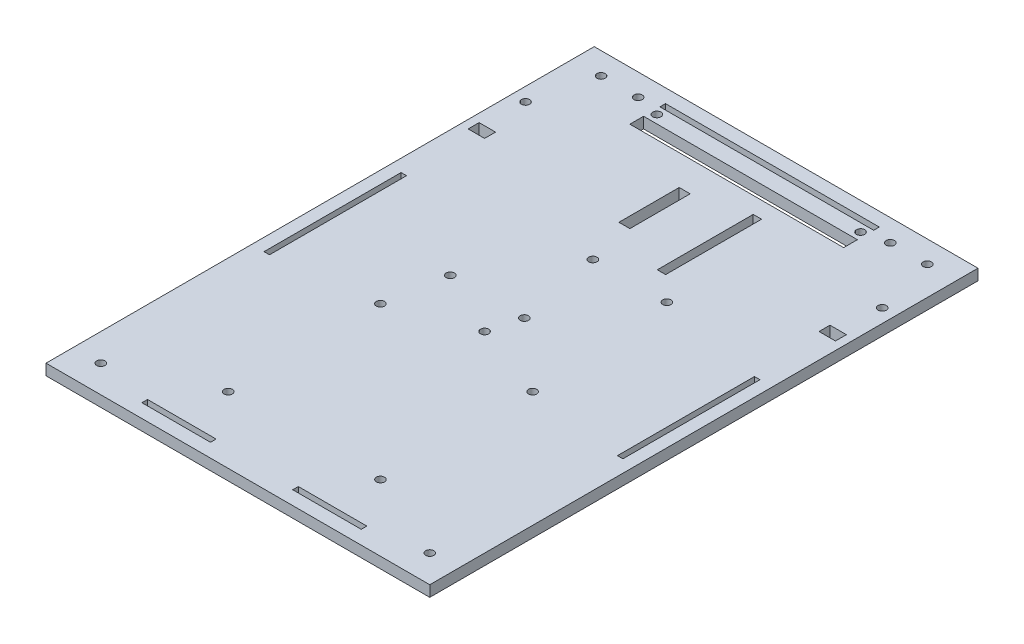
from build123d import *

# Parameters (mm, degrees)
SKETCH1_W           = 140
SKETCH1_H           = 200
BOSS_EXTRUDE1_DEPTH = 4
SKETCH2_W           = 78
SKETCH2_H           = 2.05
SKETCH2_R           = 1.5
SKETCH2_H_2         = 5
CUT_EXTRUDE3_DEPTH  = 123.131077126
SKETCH3_W           = 6
SKETCH3_H           = 4
SKETCH3_R           = 1.5
CUT_EXTRUDE5_DEPTH  = 123.131077126
SKETCH4_R           = 1.5
CUT_EXTRUDE6_DEPTH  = 123.131077126
SKETCH6_W           = 3.05
SKETCH6_H           = 35
SKETCH6_W_2         = 4
SKETCH6_H_2         = 22
CUT_EXTRUDE13_DEPTH = 4
SKETCH7_R           = 1.5
CUT_EXTRUDE15_DEPTH = 123.131077126
SKETCH8_R           = 1.5
SKETCH8_W           = 2
SKETCH8_H           = 50
SKETCH8_W_2         = 25
SKETCH8_H_2         = 2.05
CUT_EXTRUDE16_DEPTH = 4


with BuildPart() as part:
    # Sketch1 → Boss-Extrude1 (new body)
    with BuildSketch(Plane(origin=(0, 0, 0), x_dir=(1, 0, 0), z_dir=(0, 1, 0))):
        Rectangle(SKETCH1_W, SKETCH1_H)
    extrude(amount=BOSS_EXTRUDE1_DEPTH)

    # Sketch2 → Cut-Extrude3 (cut, through all)
    with BuildSketch(Plane(origin=(0, 4, 0), x_dir=(1, 0, 0), z_dir=(0, 1, 0))):
        with Locations((0, 93.975)):
            Rectangle(SKETCH2_W, SKETCH2_H)
        with Locations(Location((-37.150844364, 90, 0), (0, 0, 270))):
            Circle(SKETCH2_R)
        with Locations(Location((37.150844364, 90, 0), (0, 0, 270))):
            Circle(SKETCH2_R)
        with Locations((0, 84.5)):
            Rectangle(SKETCH2_W, SKETCH2_H_2)
    extrude(amount=-CUT_EXTRUDE3_DEPTH, mode=Mode.SUBTRACT)

    # Sketch3 → Cut-Extrude5 (cut, through all)
    with BuildSketch(Plane(origin=(0, 4, 0), x_dir=(1, 0, 0), z_dir=(0, 1, 0))):
        with Locations((-64, 53)):
            Rectangle(SKETCH3_W, SKETCH3_H)
        with Locations(Location((65.055984274, 70, 0), (0, 0, 270))):
            Circle(SKETCH3_R)
        with Locations((64, 53)):
            Rectangle(SKETCH3_W, SKETCH3_H)
        with Locations(Location((-65.055984274, 70, 0), (0, 0, 270))):
            Circle(SKETCH3_R)
    extrude(amount=-CUT_EXTRUDE5_DEPTH, mode=Mode.SUBTRACT)

    # Sketch4 → Cut-Extrude6 (cut, through all)
    with BuildSketch(Plane(origin=(0, 4, 0), x_dir=(1, 0, 0), z_dir=(0, 1, 0))):
        with Locations(Location((59.5, 92, 0), (0, 0, 270))):
            Circle(SKETCH4_R)
        with Locations(Location((-59.5, 92, 0), (0, 0, 270))):
            Circle(SKETCH4_R)
        with Locations(Location((-46, 92, 0), (0, 0, 270))):
            Circle(SKETCH4_R)
        with Locations(Location((46, 92, 0), (0, 0, 90))):
            Circle(SKETCH4_R)
    extrude(amount=-CUT_EXTRUDE6_DEPTH, mode=Mode.SUBTRACT)

    # Sketch6 → Cut-Extrude13 (cut)
    with BuildSketch(Plane(origin=(0, 4, 0), x_dir=(1, 0, 0), z_dir=(0, 1, 0))):
        with Locations((13.525, 58.5)):
            Rectangle(SKETCH6_W, SKETCH6_H)
        with Locations((-8, 60)):
            Rectangle(SKETCH6_W_2, SKETCH6_H_2)
    extrude(amount=-CUT_EXTRUDE13_DEPTH, mode=Mode.SUBTRACT)

    # Sketch7 → Cut-Extrude15 (cut, through all)
    with BuildSketch(Plane(origin=(0, 4, 0), x_dir=(1, 0, 0), z_dir=(0, 1, 0))):
        with Locations(Location((27.764169226, -20.235830774, 0), (0, 0, 270))):
            Circle(SKETCH7_R)
        with Locations(Location((-27.764169226, -75.764169226, 0), (0, 0, 270))):
            Circle(SKETCH7_R)
        with Locations(Location((27.764169226, -75.764169226, 0), (0, 0, 270))):
            Circle(SKETCH7_R)
        with Locations(Location((24, 32.5, 0), (0, 0, 270))):
            Circle(SKETCH7_R)
        with Locations(Location((3, 1.5, 0), (0, 0, 270))):
            Circle(SKETCH7_R)
        with Locations(Location((-24, 1.5, 0), (0, 0, 270))):
            Circle(SKETCH7_R)
        with Locations(Location((-3, 32.5, 0), (0, 0, 270))):
            Circle(SKETCH7_R)
        with Locations(Location((-27.764169226, -20.235830774, 0), (0, 0, 270))):
            Circle(SKETCH7_R)
    extrude(amount=-CUT_EXTRUDE15_DEPTH, mode=Mode.SUBTRACT)

    # Sketch8 → Cut-Extrude16 (cut)
    with BuildSketch(Plane(origin=(0, 4, 0), x_dir=(1, 0, 0), z_dir=(0, 1, 0))):
        with Locations(Location((0, -10, 0), (0, 0, 270))):
            Circle(SKETCH8_R)
        with Locations(Location((-60, -90, 0), (0, 0, 270))):
            Circle(SKETCH8_R)
        with Locations(Location((60, -90, 0), (0, 0, 90))):
            Circle(SKETCH8_R)
        with Locations((-64.456694017, 0)):
            Rectangle(SKETCH8_W, SKETCH8_H)
        with Locations((64.456694017, 0)):
            Rectangle(SKETCH8_W, SKETCH8_H)
        with Locations((27.5, -93.975)):
            Rectangle(SKETCH8_W_2, SKETCH8_H_2)
        with Locations((-27.5, -93.975)):
            Rectangle(SKETCH8_W_2, SKETCH8_H_2)
    extrude(amount=-CUT_EXTRUDE16_DEPTH, mode=Mode.SUBTRACT)


solid = part.part
